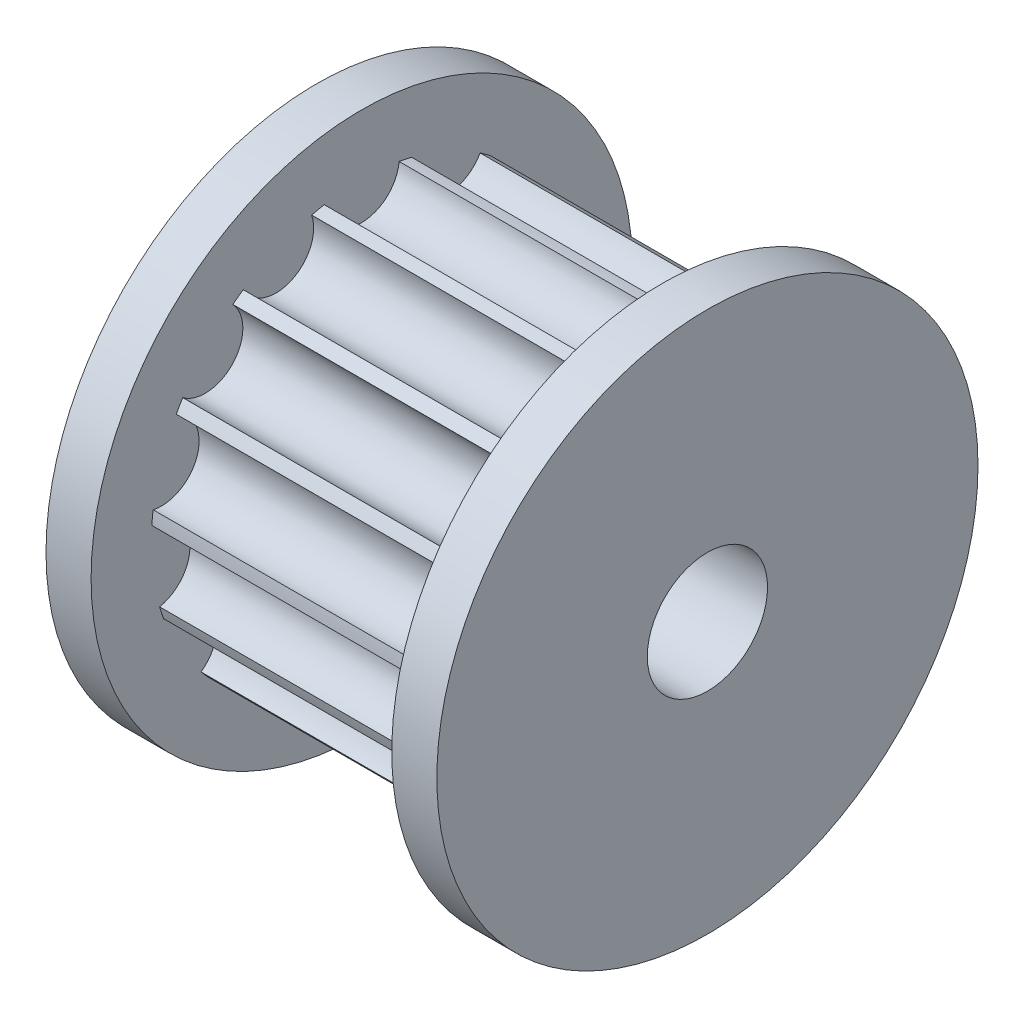
from build123d import *

# Parameters (mm, degrees)
SKETCH_3_R               = 2
CUT_EXTRUDE_2_DEPTH      = 17
SKETCH_4_W               = 2.5
SKETCH_4_H               = 2.683329606
CUT_EXTRUDE_3_DEPTH      = 17
PATTERN_CIRCULAR_1_COUNT = 15
EXTRUDE_START            = 1.5
SKETCH_5_R               = 9
SKETCH_5_R_2             = 2
EXTRUDE_1_DEPTH          = 1.5
SKETCH_6_R               = 9
SKETCH_6_R_2             = 2
EXTRUDE_2_DEPTH          = 1.5


with BuildPart() as part:
    # 草图1 → 旋转2 (revolve)
    with BuildSketch(Plane.XY, mode=Mode.PRIVATE) as revolve_2_sk:
        Polygon((-27.363734917, 8.847191366), (-27.363734917, 3.847191366), (-28.613734917, 3.847191366), (-28.613734917, 1.847191366), (-16.113734917, 1.847191366), (-16.113734917, 3.847191366), (-17.363734917, 3.847191366), (-17.363734917, 8.847191366), align=None)
    revolve(revolve_2_sk.sketch.rotate(Axis((-48.964491856, 1.847191366, 0), (1, 0, 0)), 90), axis=Axis((-48.964491856, 1.847191366, 0), (1, 0, 0)))

    # 草图3 → 切除-拉伸2 (cut)
    with BuildSketch(Plane.ZY.offset(28.613734917)):
        with Locations((0, 1.847191366)):
            Circle(SKETCH_3_R)
    extrude(amount=-CUT_EXTRUDE_2_DEPTH, mode=Mode.SUBTRACT)

    # 草图4 → 切除-拉伸3 (cut)
    with BuildSketch(Plane.ZY.offset(27.363734917)):
        with Locations((0, 10.188856169)):
            Rectangle(SKETCH_4_W, SKETCH_4_H)
        with BuildLine():
            Line((1.25, 8.847191366), (-1.25, 8.847191366))
            ThreePointArc((-1.25, 8.847191366), (0, 7.597191366), (1.25, 8.847191366))
        make_face()
    cut_extrude_3 = extrude(amount=-CUT_EXTRUDE_3_DEPTH, mode=Mode.SUBTRACT)

    # 阵列(圆周)1: 切除-拉伸3 ×15 about axis
    pattern_circular_1_axis = Axis((0, 1.847191366, 0), (1, 0, 0))
    for i in range(1, PATTERN_CIRCULAR_1_COUNT):
        add(cut_extrude_3.rotate(pattern_circular_1_axis, i * 360 / PATTERN_CIRCULAR_1_COUNT), mode=Mode.SUBTRACT)

    # 草图5 → 凸台-拉伸1 (add)
    with BuildSketch(Plane.ZY.offset(27.363734917).offset(EXTRUDE_START)):
        with Locations((0, 1.847191366)):
            Circle(SKETCH_5_R)
        with Locations((0, 1.847191366)):
            Circle(SKETCH_5_R_2, mode=Mode.SUBTRACT)
    extrude(amount=-EXTRUDE_1_DEPTH)

    # 草图6 → 凸台-拉伸2 (add)
    with BuildSketch(Plane(origin=(-17.363734917, 0, 0), x_dir=(0, 0, -1), z_dir=(1, 0, 0))):
        with Locations(Location((0, 1.847191366, 0), (0, 0, 180))):
            Circle(SKETCH_6_R)
        with Locations(Location((0, 1.847191366, 0), (0, 0, 180))):
            Circle(SKETCH_6_R_2, mode=Mode.SUBTRACT)
    extrude(amount=EXTRUDE_2_DEPTH)


solid = part.part
